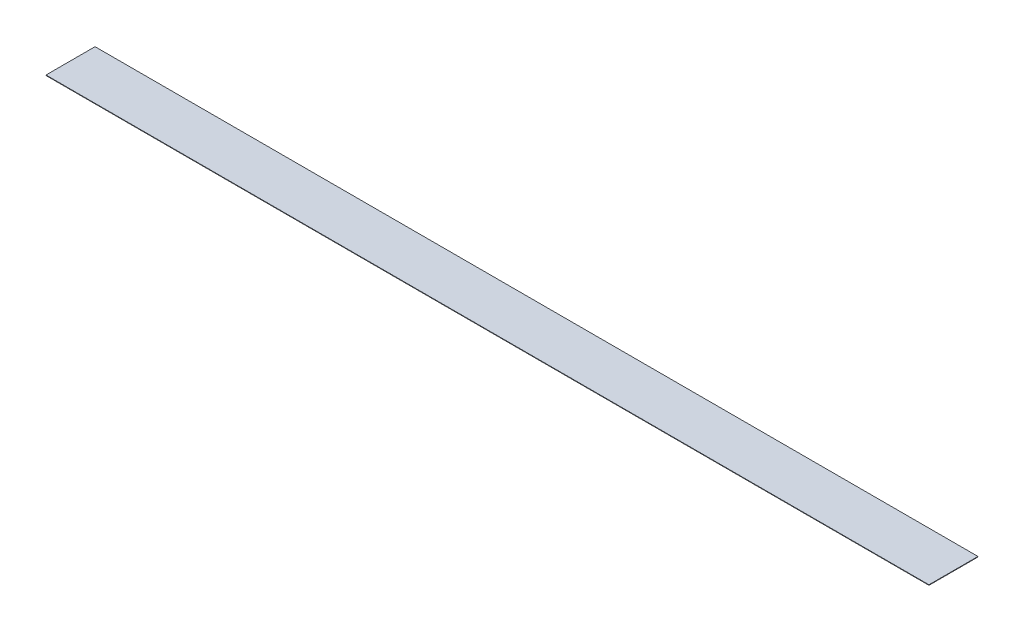
from build123d import *

# Parameters (mm, degrees)
SKETCH1_W           = 228.6
SKETCH1_H           = 12.7
BOSS_EXTRUDE1_DEPTH = 0.125


with BuildPart() as part:
    # Sketch1 → Boss-Extrude1 (new body)
    with BuildSketch(Plane(origin=(0, 0, 0), x_dir=(1, 0, 0), z_dir=(0, 1, 0))):
        Rectangle(SKETCH1_W, SKETCH1_H)
    extrude(amount=BOSS_EXTRUDE1_DEPTH)


solid = part.part
